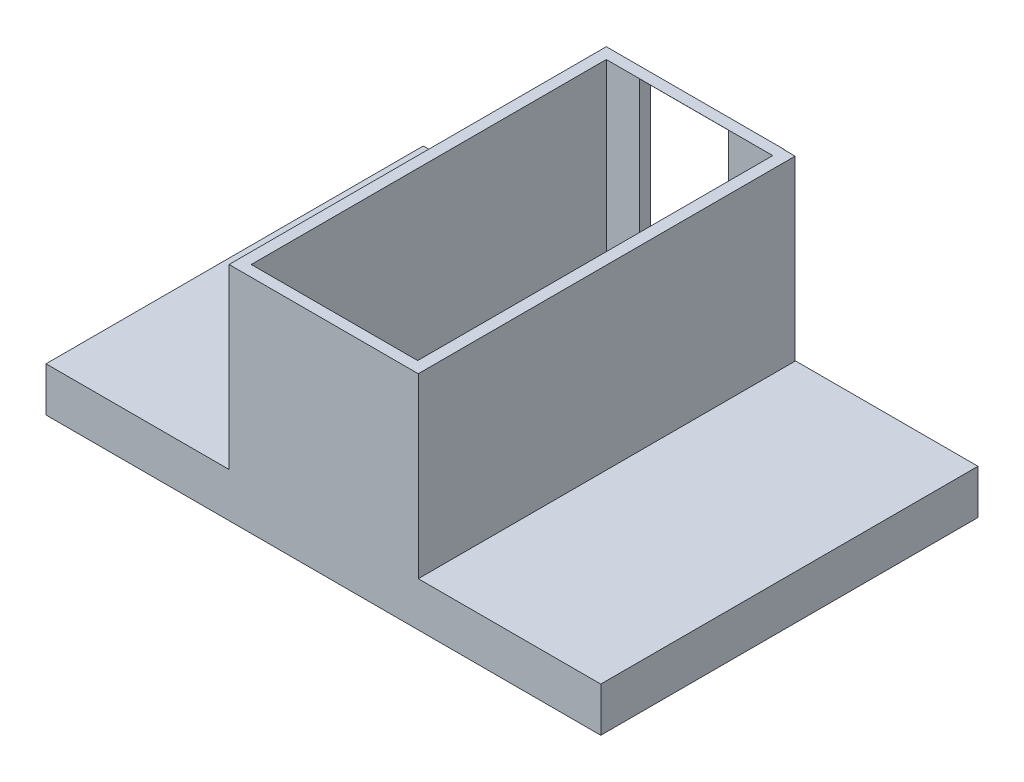
from build123d import *

# Parameters (mm, degrees)
SKETCH1_W           = 63.5
SKETCH1_H           = 21.59
BOSS_EXTRUDE1_DEPTH = 5.08
SKETCH2_W           = 19.05
SKETCH2_H           = 20.32
BOSS_EXTRUDE2_DEPTH = 1.27
SKETCH3_W           = 1.27
SKETCH3_H           = 21.59
BOSS_EXTRUDE3_DEPTH = 20.32
SKETCH4_W           = 1.336000662
SKETCH4_H           = 43.13668157
BOSS_EXTRUDE4_DEPTH = 20.32
SKETCH5_W           = 10.16
SKETCH5_H           = 20.215193183
CUT_EXTRUDE2_DEPTH  = 1.27


with BuildPart() as part:
    # Sketch1 → Boss-Extrude1 (new body)
    with BuildSketch(Plane(origin=(0, 0, 0), x_dir=(1, 0, 0), z_dir=(0, 1, 0))):
        with Locations((-28.979219315, -15.643333637)):
            Rectangle(SKETCH1_W, SKETCH1_H)
    boss_extrude1 = extrude(amount=BOSS_EXTRUDE1_DEPTH)

    # Sketch2 → Boss-Extrude2 (add)
    with BuildSketch(Plane.XY.offset(26.438333637)):
        with Locations((-28.979219315, 15.24)):
            Rectangle(SKETCH2_W, SKETCH2_H)
    boss_extrude2 = extrude(amount=-BOSS_EXTRUDE2_DEPTH)

    # Sketch3 → Boss-Extrude3 (add)
    with BuildSketch(Plane(origin=(0, 5.08, 0), x_dir=(1, 0, 0), z_dir=(0, 1, 0))):
        with Locations((-39.139219315, -15.643333637)):
            Rectangle(SKETCH3_W, SKETCH3_H)
    boss_extrude3 = extrude(amount=BOSS_EXTRUDE3_DEPTH)

    # Mirror2: Boss-Extrude1, Boss-Extrude2, Boss-Extrude3 across plane
    add(boss_extrude1.mirror(Plane(origin=(-60.729219315, 5.08, 4.848333637), x_dir=(1, 0, 0), z_dir=(0, 0, 1))))
    add(boss_extrude2.mirror(Plane(origin=(-60.729219315, 5.08, 4.848333637), x_dir=(1, 0, 0), z_dir=(0, 0, 1))))
    add(boss_extrude3.mirror(Plane(origin=(-60.729219315, 5.08, 4.848333637), x_dir=(1, 0, 0), z_dir=(0, 0, 1))))

    # Sketch4 → Boss-Extrude4 (add)
    with BuildSketch(Plane(origin=(0, 5.08, 0), x_dir=(1, 0, 0), z_dir=(0, 1, 0))):
        with Locations((-18.786218984, -4.869992852)):
            Rectangle(SKETCH4_W, SKETCH4_H)
    extrude(amount=BOSS_EXTRUDE4_DEPTH)

    # Sketch5 → Cut-Extrude2 (cut)
    with BuildSketch(Plane(origin=(0, 0, -16.741666363), x_dir=(-1, 0, 0), z_dir=(0, 0, -1))):
        with Locations((29.613387645, 15.279515477)):
            Rectangle(SKETCH5_W, SKETCH5_H)
    extrude(amount=-CUT_EXTRUDE2_DEPTH, mode=Mode.SUBTRACT)


solid = part.part
